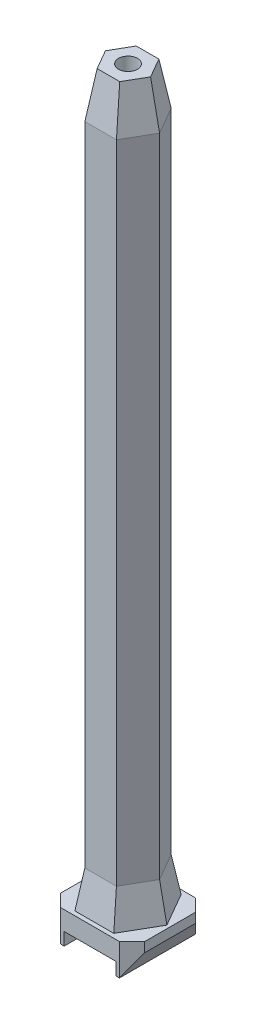
from build123d import *
from OCP.BRepFilletAPI import BRepFilletAPI_MakeChamfer

# Parameters (mm, degrees)
SKETCH1_W           = 13.29305136
SKETCH1_H           = 12
BOSS_EXTRUDE1_DEPTH = 120
SKETCH2_W           = 8.2
SKETCH2_H           = 54.027992046
CUT_EXTRUDE1_DEPTH  = 2
SKETCH3_R           = 1.5
CUT_EXTRUDE2_DEPTH  = 140
SKETCH4_OUTSIDE_W   = 39.56
SKETCH4_OUTSIDE_H   = 38.266
CUT_EXTRUDE3_DEPTH  = 115
CHAMFER1_SIZE       = 1
CHAMFER1_SIZE2      = 5.67128182
CHAMFER2_SIZE       = 2
CHAMFER3_SIZE       = 7
CHAMFER3_SIZE2      = 1.234288865
CHAMFER4_SIZE       = 2
CHAMFER4_SIZE2      = 3.464101615


with BuildPart() as part:
    # Sketch1 → Boss-Extrude1 (new body)
    with BuildSketch(Plane(origin=(0, 0, 0), x_dir=(1, 0, 0), z_dir=(0, 1, 0))):
        Rectangle(SKETCH1_W, SKETCH1_H)
    extrude(amount=BOSS_EXTRUDE1_DEPTH)

    # Sketch2 → Cut-Extrude1 (cut)
    with BuildSketch(Plane.XZ):
        Rectangle(SKETCH2_W, SKETCH2_H)
    extrude(amount=-CUT_EXTRUDE1_DEPTH, mode=Mode.SUBTRACT)

    # Sketch3 → Cut-Extrude2 (cut)
    with BuildSketch(Plane(origin=(0, 120, 0), x_dir=(1, 0, 0), z_dir=(0, 1, 0))):
        with Locations(Location((0, 0, 0), (0, 0, 270))):
            Circle(SKETCH3_R)
    extrude(amount=-CUT_EXTRUDE2_DEPTH, mode=Mode.SUBTRACT)

    # Sketch4 outside → Cut-Extrude3 (cut)
    with BuildSketch(Plane(origin=(0, 120, 0), x_dir=(1, 0, 0), z_dir=(0, 1, 0))):
        Rectangle(SKETCH4_OUTSIDE_W, SKETCH4_OUTSIDE_H)
        Polygon((-2.5, -4.330127019), (2.5, -4.330127019), (5, 0), (2.5, 4.330127019), (-2.5, 4.330127019), (-5, 0), align=None, mode=Mode.SUBTRACT)
    extrude(amount=-CUT_EXTRUDE3_DEPTH, mode=Mode.SUBTRACT)

    # Chamfer1
    chamfer1_edges = [part.edges().sort_by_distance(p)[0] for p in [
        (0, 5, 4.330127019),
        (3.75, 5, 2.165063509),
        (3.75, 5, -2.165063509),
        (0, 5, -4.330127019),
        (-3.75, 5, -2.165063509),
        (-3.75, 5, 2.165063509),
    ]]
    chamfer1_side = [part.faces().sort_by_distance(p)[0] for p in [
        (-6.467443237, 5, 0),
    ]]
    chamfer(chamfer1_edges, length=CHAMFER1_SIZE, length2=CHAMFER1_SIZE2, reference=chamfer1_side[0])

    # Chamfer2
    chamfer2_edges = [part.edges().sort_by_distance(p)[0] for p in [
        (6.64652568, 2.5, 6),
        (-6.64652568, 2.5, 6),
        (-6.64652568, 2.5, -6),
        (6.64652568, 2.5, -6),
    ]]
    chamfer(chamfer2_edges, length=CHAMFER2_SIZE)

    # Chamfer3: one chamfer whose edges measure the first distance from different faces: ONE call of the kernel's chamfer builder (chamfer() names one face for all edges)
    chamfer3_edges_1 = [part.edges().sort_by_distance(p)[0] for p in [
        (3.75, 120, 2.165063509),
    ]]
    chamfer3_side_1 = [part.faces().sort_by_distance(p)[0] for p in [
        (3.75, 65.33564091, 2.165063509),
    ]]
    chamfer3_edges_2 = [part.edges().sort_by_distance(p)[0] for p in [
        (0, 120, 4.330127019),
    ]]
    chamfer3_side_2 = [part.faces().sort_by_distance(p)[0] for p in [
        (0, 65.33564091, 4.330127019),
    ]]
    chamfer3_edges_3 = [part.edges().sort_by_distance(p)[0] for p in [
        (-3.75, 120, 2.165063509),
    ]]
    chamfer3_side_3 = [part.faces().sort_by_distance(p)[0] for p in [
        (-3.75, 65.33564091, 2.165063509),
    ]]
    chamfer3_edges_4 = [part.edges().sort_by_distance(p)[0] for p in [
        (-3.75, 120, -2.165063509),
    ]]
    chamfer3_side_4 = [part.faces().sort_by_distance(p)[0] for p in [
        (-3.75, 65.33564091, -2.165063509),
    ]]
    chamfer3_edges_5 = [part.edges().sort_by_distance(p)[0] for p in [
        (0, 120, -4.330127019),
    ]]
    chamfer3_side_5 = [part.faces().sort_by_distance(p)[0] for p in [
        (0, 65.33564091, -4.330127019),
    ]]
    chamfer3_edges_6 = [part.edges().sort_by_distance(p)[0] for p in [
        (3.75, 120, -2.165063509),
    ]]
    chamfer3_side_6 = [part.faces().sort_by_distance(p)[0] for p in [
        (3.75, 65.33564091, -2.165063509),
    ]]
    chamfer3 = BRepFilletAPI_MakeChamfer(part.part.solid().wrapped)
    for e in chamfer3_edges_1:
        chamfer3.Add(CHAMFER3_SIZE, CHAMFER3_SIZE2, e.wrapped, chamfer3_side_1[0].wrapped)  # the first distance lies on this face
    for e in chamfer3_edges_2:
        chamfer3.Add(CHAMFER3_SIZE, CHAMFER3_SIZE2, e.wrapped, chamfer3_side_2[0].wrapped)  # the first distance lies on this face
    for e in chamfer3_edges_3:
        chamfer3.Add(CHAMFER3_SIZE, CHAMFER3_SIZE2, e.wrapped, chamfer3_side_3[0].wrapped)  # the first distance lies on this face
    for e in chamfer3_edges_4:
        chamfer3.Add(CHAMFER3_SIZE, CHAMFER3_SIZE2, e.wrapped, chamfer3_side_4[0].wrapped)  # the first distance lies on this face
    for e in chamfer3_edges_5:
        chamfer3.Add(CHAMFER3_SIZE, CHAMFER3_SIZE2, e.wrapped, chamfer3_side_5[0].wrapped)  # the first distance lies on this face
    for e in chamfer3_edges_6:
        chamfer3.Add(CHAMFER3_SIZE, CHAMFER3_SIZE2, e.wrapped, chamfer3_side_6[0].wrapped)  # the first distance lies on this face
    add(Compound.cast(chamfer3.Shape()), mode=Mode.REPLACE)

    # Chamfer4: one chamfer whose edges measure the first distance from different faces: ONE call of the kernel's chamfer builder (chamfer() names one face for all edges)
    chamfer4_edges_1 = [part.edges().sort_by_distance(p)[0] for p in [
        (-6.64652568, 0, 0),
    ]]
    chamfer4_side_1 = [part.faces().sort_by_distance(p)[0] for p in [
        (-5.281902175, 0, 0),
    ]]
    chamfer4_edges_2 = [part.edges().sort_by_distance(p)[0] for p in [
        (6.64652568, 0, 0),
    ]]
    chamfer4_side_2 = [part.faces().sort_by_distance(p)[0] for p in [
        (5.281902175, 0, 0),
    ]]
    chamfer4 = BRepFilletAPI_MakeChamfer(part.part.solid().wrapped)
    for e in chamfer4_edges_1:
        chamfer4.Add(CHAMFER4_SIZE, CHAMFER4_SIZE2, e.wrapped, chamfer4_side_1[0].wrapped)  # the first distance lies on this face
    for e in chamfer4_edges_2:
        chamfer4.Add(CHAMFER4_SIZE, CHAMFER4_SIZE2, e.wrapped, chamfer4_side_2[0].wrapped)  # the first distance lies on this face
    add(Compound.cast(chamfer4.Shape()), mode=Mode.REPLACE)


solid = part.part
